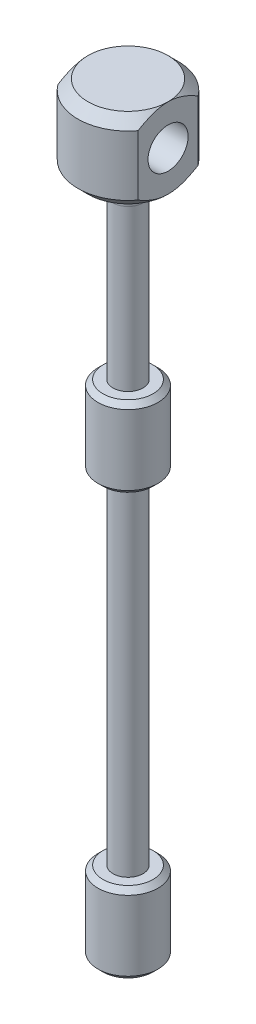
from build123d import *

# Parameters (mm, degrees)
SKETCH1_R           = 1.5
BOSS_EXTRUDE1_DEPTH = 17
SKETCH3_R           = 3
BOSS_EXTRUDE2_DEPTH = 8
BOSS_EXTRUDE3_START = 18
SKETCH4_R           = 1.5
BOSS_EXTRUDE3_DEPTH = 18
SKETCH5_R           = 5
BOSS_EXTRUDE4_DEPTH = 8
CHAMFER1_SIZE       = 1
CHAMFER2_SIZE       = 0.5
CUT_EXTRUDE1_START  = -12
CUT_EXTRUDE1_DEPTH  = 12
SKETCH7_R           = 2
CUT_EXTRUDE2_DEPTH  = 12
FILLET1_R           = 2


with BuildPart() as part:
    # Sketch1 → Boss-Extrude1 (new, symmetric)
    with BuildSketch(Plane(origin=(0, 0, 0), x_dir=(1, 0, 0), z_dir=(0, 1, 0))):
        with Locations(Location((0, 0, 0), (0, 0, 270))):
            Circle(SKETCH1_R)
    extrude(amount=BOSS_EXTRUDE1_DEPTH, both=True)

    # Sketch3 → Boss-Extrude2 (add)
    with BuildSketch(Plane.XZ.offset(17)):
        with Locations(Location((0, 0, 0), (0, 0, 270))):
            Circle(SKETCH3_R)
    boss_extrude2 = extrude(amount=BOSS_EXTRUDE2_DEPTH)

    # Mirror1: Boss-Extrude2 across plane
    add(boss_extrude2.mirror(Plane.ZX))

    # Sketch4 → Boss-Extrude3 (add)
    with BuildSketch(Plane(origin=(0, 25, 0), x_dir=(1, 0, 0), z_dir=(0, 1, 0)).offset(BOSS_EXTRUDE3_START)):
        with Locations(Location((0, 0, 0), (0, 0, 270))):
            Circle(SKETCH4_R)
    extrude(amount=-BOSS_EXTRUDE3_DEPTH)

    # Sketch5 → Boss-Extrude4 (add)
    with BuildSketch(Plane(origin=(0, 43, 0), x_dir=(1, 0, 0), z_dir=(0, 1, 0))):
        with Locations(Location((0, 0, 0), (0, 0, 270))):
            Circle(SKETCH5_R)
    extrude(amount=BOSS_EXTRUDE4_DEPTH)

    # Chamfer1
    chamfer1_edges = [part.edges().sort_by_distance(p)[0] for p in [
        (0, 43, -5),
        (0, 51, -5),
    ]]
    chamfer(chamfer1_edges, length=CHAMFER1_SIZE)

    # Chamfer2
    chamfer2_edges = [part.edges().sort_by_distance(p)[0] for p in [
        (0, 25, 3),
        (0, 17, 3),
        (0, -17, 3),
        (0, -25, 3),
    ]]
    chamfer(chamfer2_edges, length=CHAMFER2_SIZE)

    # Sketch6 → Cut-Extrude1 (cut)
    with BuildSketch(Plane(origin=(0, 51, 0), x_dir=(1, 0, 0), z_dir=(0, 1, 0)).offset(CUT_EXTRUDE1_START)):
        with BuildLine():
            Line((-4, 3), (-4, -3))
            ThreePointArc((-4, -3), (-5, 0), (-4, 3))
        make_face()
        with BuildLine():
            Line((4, 3), (4, -3))
            ThreePointArc((4, -3), (5, 0), (4, 3))
        make_face()
    extrude(amount=CUT_EXTRUDE1_DEPTH, mode=Mode.SUBTRACT)

    # Sketch7 → Cut-Extrude2 (cut)
    with BuildSketch(Plane.ZY.offset(4)):
        with Locations((0, 47)):
            Circle(SKETCH7_R)
    extrude(amount=-CUT_EXTRUDE2_DEPTH, mode=Mode.SUBTRACT)

    # Fillet1
    fillet1_edges = [part.edges().sort_by_distance(p)[0] for p in [
        (0, 43, -1.5),
    ]]
    fillet(fillet1_edges, radius=FILLET1_R)


solid = part.part
